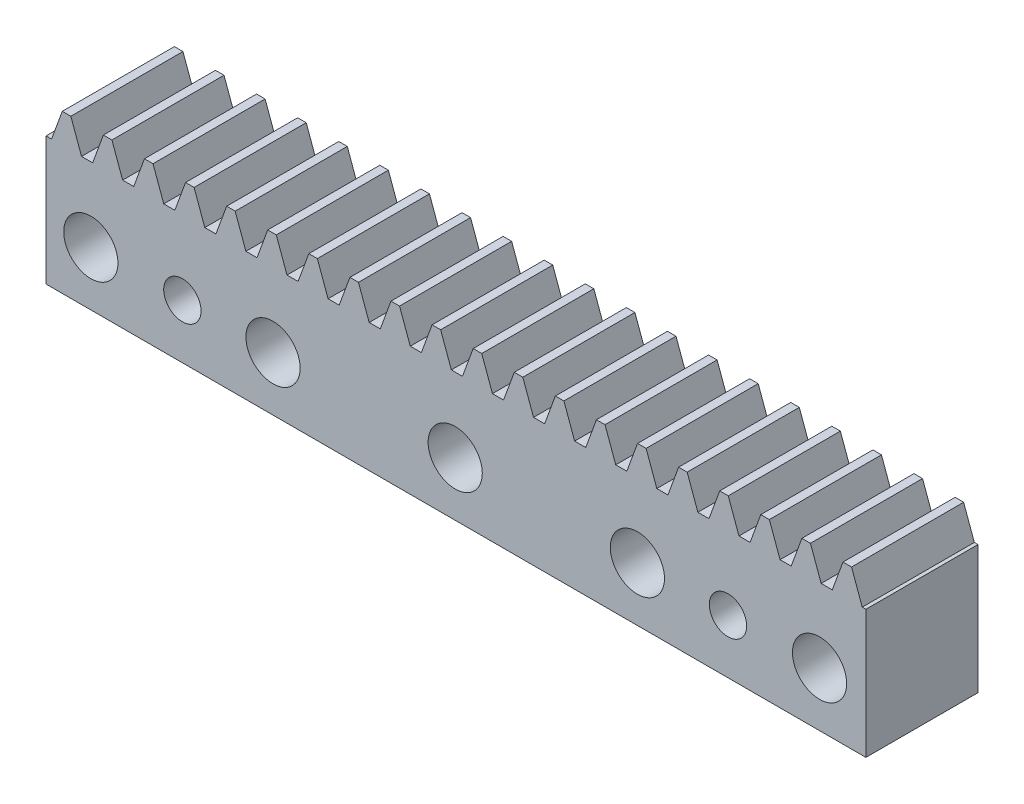
from build123d import *

# Parameters (mm, degrees)
BLANKSKE_W               = 877.6
BLANKSKE_H               = 168.84
BLANK_DEPTH              = 120
TOOTHCUTSIM_DEPTH        = 902.714314847
TEETHCUTS_COUNT          = 21
TEETHCUTS_PITCH          = 43.9822971
SKETCH_1_R               = 29
SKETCH_1_R_2             = 20
CUT_EXTRUDE_2_DEPTH      = 60
SKETCH_2_R               = 21
CUT_EXTRUDE_3_DEPTH      = 60
HOLE_WIZARD_1_AT_2_COUNT = 2
HOLE_WIZARD_1_AT_2_PITCH = 584


with BuildPart() as part:
    # BlankSke → Blank (new body)
    with BuildSketch(Plane.XY):
        with Locations((438.8, 84.42)):
            Rectangle(BLANKSKE_W, BLANKSKE_H)
    extrude(amount=-BLANK_DEPTH)

    # TooCutSkeSim → ToothCutSim (cut, through all)
    with BuildSketch(Plane.XY):
        Polygon((5.946095175, 137.34), (-5.946095175, 137.34), (-17.420402399, 168.8654), (17.420402399, 168.8654), align=None)
    toothcutsim = extrude(amount=-TOOTHCUTSIM_DEPTH, mode=Mode.SUBTRACT)

    # TeethCuts: ToothCutSim ×21
    with Locations(*[(i * TEETHCUTS_PITCH, 0, 0) for i in range(1, TEETHCUTS_COUNT)]):
        add(toothcutsim, mode=Mode.SUBTRACT)

    # 草图1 → 切除-拉伸2 (cut)
    with BuildSketch(Plane.XY):
        with Locations((48, 58)):
            Circle(SKETCH_1_R)
        with Locations((146, 58)):
            Circle(SKETCH_1_R_2)
        with Locations((243, 58)):
            Circle(SKETCH_1_R)
        with Locations((438, 58)):
            Circle(SKETCH_1_R)
        with Locations((633, 58)):
            Circle(SKETCH_1_R)
        with Locations((730, 58)):
            Circle(SKETCH_1_R_2)
        with Locations((828, 58)):
            Circle(SKETCH_1_R)
    extrude(amount=-CUT_EXTRUDE_2_DEPTH, mode=Mode.SUBTRACT)

    # 草图2 → 切除-拉伸3 (cut)
    with BuildSketch(Plane.XY.offset(-60)):
        with Locations((48, 58)):
            Circle(SKETCH_2_R)
        with Locations((243, 58)):
            Circle(SKETCH_2_R)
        with Locations((438, 58)):
            Circle(SKETCH_2_R)
        with Locations((633, 58)):
            Circle(SKETCH_2_R)
        with Locations((828, 58)):
            Circle(SKETCH_2_R)
    extrude(amount=-CUT_EXTRUDE_3_DEPTH, mode=Mode.SUBTRACT)

    # 草图6 → 孔1 (revolve, cut)
    with BuildSketch(Plane(origin=(146, 58, -60), x_dir=(0, -1, 0), z_dir=(1, 0, 0))):
        Polygon((0, 0), (0, 60), (10, 60), (15, 0), align=None)
    hole_wizard_1 = revolve(axis=Axis((146, 58, -170), (0, 0, 1)), mode=Mode.SUBTRACT)

    # 孔1 at 2: 孔1 ×2
    with Locations(*[(i * HOLE_WIZARD_1_AT_2_PITCH, 0, 0) for i in range(1, HOLE_WIZARD_1_AT_2_COUNT)]):
        add(hole_wizard_1, mode=Mode.SUBTRACT)


solid = part.part
